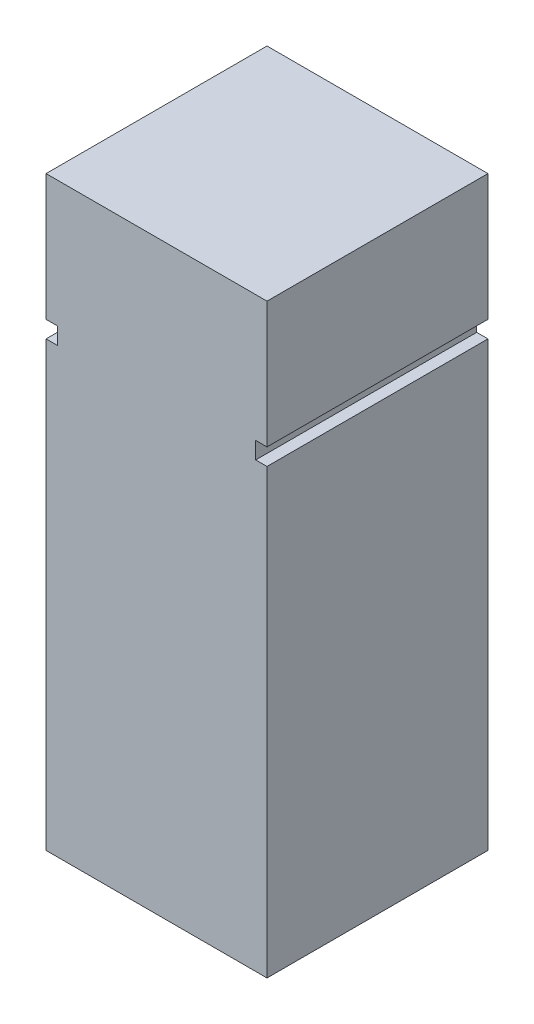
from build123d import *

# Parameters (mm, degrees)
SKETCH1_W           = 24.892
SKETCH1_H           = 66.04
BOSS_EXTRUDE1_DEPTH = 24.892
SKETCH2_W           = 1.27
SKETCH2_H           = 1.905
CUT_EXTRUDE1_DEPTH  = 24.892


with BuildPart() as part:
    # Sketch1 → Boss-Extrude1 (new body)
    with BuildSketch(Plane.XY):
        with Locations((-19.30617793, -10.072241476)):
            Rectangle(SKETCH1_W, SKETCH1_H)
    extrude(amount=BOSS_EXTRUDE1_DEPTH)

    # Sketch2 → Cut-Extrude1 (cut)
    with BuildSketch(Plane.XY.offset(24.892)):
        with Locations((-31.11717793, 7.771258524)):
            Rectangle(SKETCH2_W, SKETCH2_H)
        with Locations((-7.49517793, 7.771258524)):
            Rectangle(SKETCH2_W, SKETCH2_H)
    extrude(amount=-CUT_EXTRUDE1_DEPTH, mode=Mode.SUBTRACT)


solid = part.part
